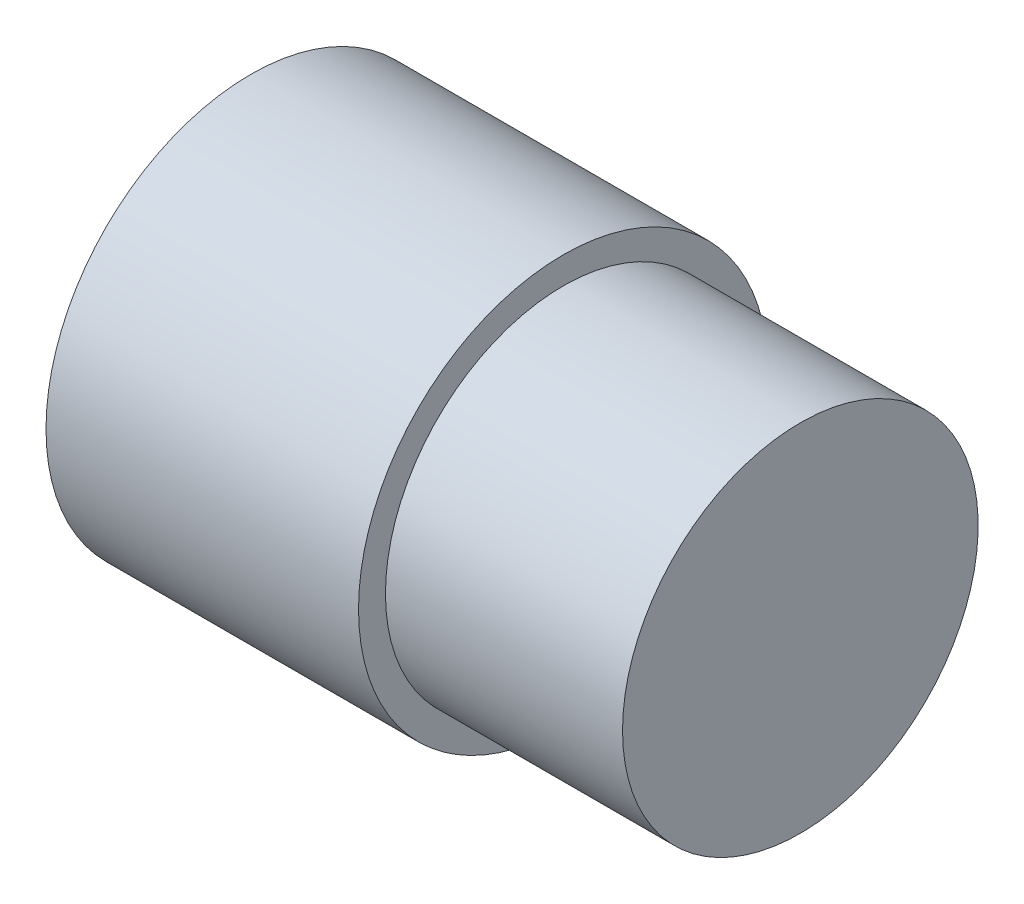
from build123d import *

# Parameters (mm, degrees)
SKETCH1_W = 22
SKETCH1_H = 16.5


with BuildPart() as part:
    # Sketch1 → Revolve2 (revolve)
    with BuildSketch(Plane(origin=(0, 0, 0), x_dir=(1, 0, 0), z_dir=(0, 1, 0)), mode=Mode.PRIVATE) as revolve2_sk:
        Polygon((-14.5, 19), (-14.5, 0), (14.5, 0), (14.5, 16.5), (14.5, 19), align=None)
        with Locations((25.5, 8.25)):
            Rectangle(SKETCH1_W, SKETCH1_H)
    revolve(revolve2_sk.sketch.rotate(Axis((-14.5, 0, 0), (1, 0, 0)), 180), axis=Axis((-14.5, 0, 0), (1, 0, 0)))


solid = part.part
